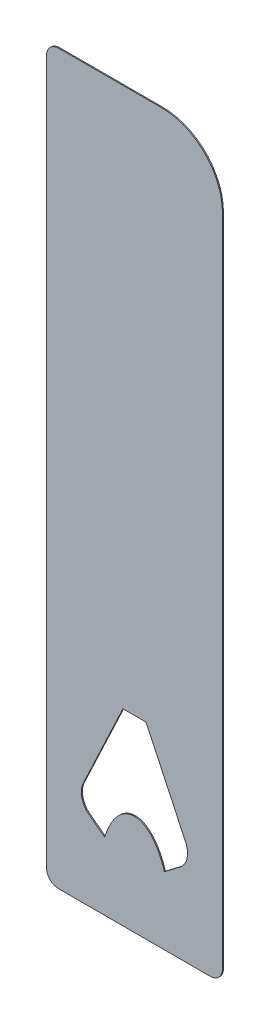
from build123d import *

# Parameters (mm, degrees)
BOSS_EXTRUDE6_DEPTH = 0.17
CUT_EXTRUDE4_DEPTH  = 62.727456614


with BuildPart() as part:
    # Sketch20 → Boss-Extrude6 (new body)
    with BuildSketch(Plane.XY):
        with BuildLine():
            Line((-12.5, 60), (4.5, 60))
            ThreePointArc((4.5, 60), (11.571067812, 57.071067812), (14.5, 50))
            Line((14.5, 50), (14.5, -58))
            ThreePointArc((14.5, -58), (13.914213562, -59.414213562), (12.5, -60))
            Line((12.5, -60), (-12.5, -60))
            ThreePointArc((-12.5, -60), (-13.914213562, -59.414213562), (-14.5, -58))
            Line((-14.5, -58), (-14.5, 58))
            ThreePointArc((-14.5, 58), (-13.914213562, 59.414213562), (-12.5, 60))
        make_face()
    extrude(amount=BOSS_EXTRUDE6_DEPTH)

    # Sketch14 → Cut-Extrude4 (cut, through all)
    with BuildSketch(Plane.XY.offset(0.17)):
        with BuildLine():
            Line((-1.9, -29), (1.9, -29))
            Line((1.9, -29), (8.375, -42.75))
            add(Edge.make_bspline(
                [(8.375, -42.75), (8.614001568, -43.20601542), (8.749703343, -43.736930638), (8.75, -44.3)],
                knots=[2, 2, 2, 2, 3, 3, 3, 3], degree=3))
            add(Edge.make_bspline(
                [(8.75, -44.3), (8.75059415, -45.427724457), (8.211440188, -46.416320927), (7.4, -46.97314145)],
                knots=[3, 3, 3, 3, 3.998304655, 3.998304655, 3.998304655, 3.998304655], degree=3))
            Line((7.4, -46.97314145), (4.925, -48.85))
            add(Edge.make_bspline(
                [(4.925, -48.85), (3.956162506, -45.631727685), (2.146734918, -43.400643505), (0, -43.4)],
                knots=[5.0019278, 5.0019278, 5.0019278, 5.0019278, 5.999902224, 5.999902224, 5.999902224, 5.999902224], degree=3))
            add(Edge.make_bspline(
                [(-4.925, -48.85), (-3.956162506, -45.631727685), (-2.146734918, -43.400643505), (0, -43.4)],
                knots=[5.0019278, 5.0019278, 5.0019278, 5.0019278, 5.999902224, 5.999902224, 5.999902224, 5.999902224], degree=3))
            Line((-4.925, -48.85), (-7.4, -46.97314145))
            add(Edge.make_bspline(
                [(-8.75, -44.3), (-8.75059415, -45.427724457), (-8.211440188, -46.416320927), (-7.4, -46.97314145)],
                knots=[3, 3, 3, 3, 3.998304655, 3.998304655, 3.998304655, 3.998304655], degree=3))
            add(Edge.make_bspline(
                [(-8.375, -42.75), (-8.614001568, -43.20601542), (-8.749703343, -43.736930638), (-8.75, -44.3)],
                knots=[2, 2, 2, 2, 3, 3, 3, 3], degree=3))
            Line((-8.375, -42.75), (-1.9, -29))
        make_face()
    extrude(amount=-CUT_EXTRUDE4_DEPTH, mode=Mode.SUBTRACT)


solid = part.part
